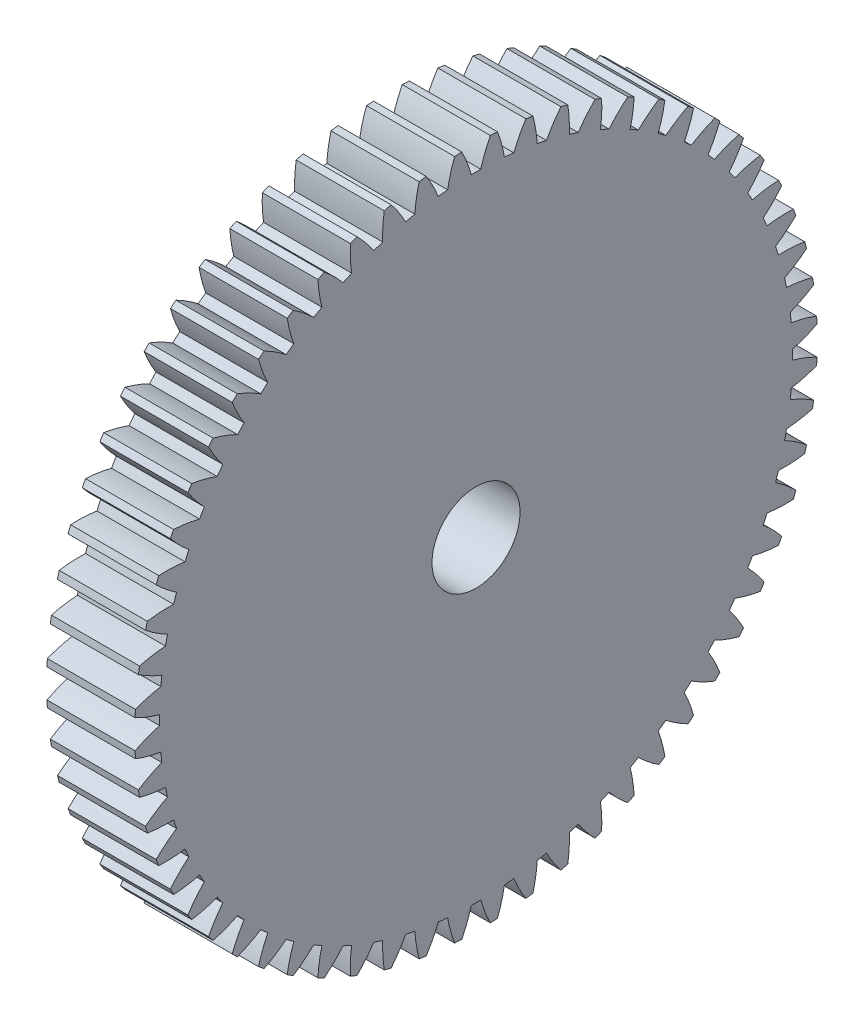
from build123d import *

# Parameters (mm, degrees)
BASPROSKE_W     = 8
BASPROSKE_H     = 31
TOOTHCUT_DEPTH  = 45.56455991
TEETHCUTS_COUNT = 60
TEETHCUTS_ANGLE = 354
BORSKE_R        = 4
BORE_DEPTH      = 50.0000508


with BuildPart() as part:
    # BasProSke → Base-Revolve (revolve)
    with BuildSketch(Plane(origin=(0, 0, 0), x_dir=(1, 0, 0), z_dir=(0, 1, 0)), mode=Mode.PRIVATE) as base_revolve_sk:
        with Locations((4, 15.5)):
            Rectangle(BASPROSKE_W, BASPROSKE_H)
    revolve(base_revolve_sk.sketch.rotate(Axis((-10, 0, 0), (1, 0, 0)), 180), axis=Axis((-10, 0, 0), (1, 0, 0)))

    # TooCutSke → ToothCut (cut, through all)
    with BuildSketch(Plane(origin=(0, 0, 0), x_dir=(0, 0, -1), z_dir=(1, 0, 0))):
        with BuildLine():
            ThreePointArc((0.430151971, 28.745781782), (0, 28.749), (-0.430151971, 28.745781782))
            ThreePointArc((-0.430151971, 28.745781782), (-0.81454129, 29.893990802), (-1.312684569, 30.997617721))
            ThreePointArc((-1.312684569, 30.997617721), (0, 31.0254), (1.312684569, 30.997617721))
            ThreePointArc((1.312684569, 30.997617721), (0.81454129, 29.893990802), (0.430151971, 28.745781782))
        make_face()
    toothcut = extrude(amount=TOOTHCUT_DEPTH, mode=Mode.SUBTRACT)

    # TeethCuts: ToothCut ×60 about axis
    teethcuts_axis = Axis((-10, 0, 0), (1, 0, 0))
    for i in range(1, TEETHCUTS_COUNT):
        add(toothcut.rotate(teethcuts_axis, i * TEETHCUTS_ANGLE / (TEETHCUTS_COUNT - 1)), mode=Mode.SUBTRACT)

    # BorSke → Bore (cut, symmetric)
    with BuildSketch(Plane(origin=(0, 0, 0), x_dir=(0, 0, -1), z_dir=(1, 0, 0))):
        with Locations(Location((0, 0, 0), (0, 0, 180))):
            Circle(BORSKE_R)
    extrude(amount=BORE_DEPTH, both=True, mode=Mode.SUBTRACT)


solid = part.part
